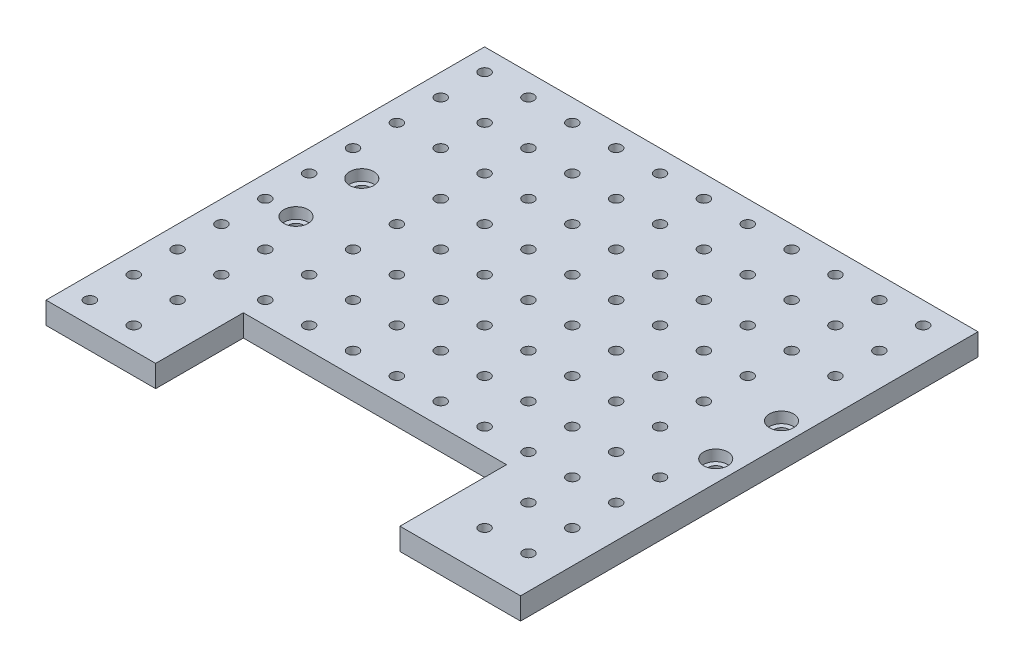
from build123d import *

# Parameters (mm, degrees)
SKETCH1_R           = 3.175
BOSS_EXTRUDE1_DEPTH = 12.7
SKETCH2_R           = 6.985
CUT_EXTRUDE1_DEPTH  = 6.35
SKETCH2_3_R         = 4.191
CUT_EXTRUDE2_DEPTH  = 12.7


with BuildPart() as part:
    # Sketch1 → Boss-Extrude1 (new body)
    with BuildSketch(Plane(origin=(0, 0, 0), x_dir=(1, 0, 0), z_dir=(0, 1, 0))):
        Polygon((63.5, 0), (215.9, 0), (215.9, -61.722), (285.75, -61.722), (285.75, 0), (285.75, 203.2), (0, 203.2), (0, 0), (0, -50.8), (63.5, -50.8), align=None)
        with Locations(Location((12.7, 190.5, 0), (0, 0, 270))):
            Circle(SKETCH1_R, mode=Mode.SUBTRACT)
        with Locations(Location((38.1, 190.5, 0), (0, 0, 270))):
            Circle(SKETCH1_R, mode=Mode.SUBTRACT)
        with Locations(Location((63.5, 190.5, 0), (0, 0, 270))):
            Circle(SKETCH1_R, mode=Mode.SUBTRACT)
        with Locations(Location((88.9, 190.5, 0), (0, 0, 270))):
            Circle(SKETCH1_R, mode=Mode.SUBTRACT)
        with Locations(Location((114.3, 190.5, 0), (0, 0, 270))):
            Circle(SKETCH1_R, mode=Mode.SUBTRACT)
        with Locations(Location((139.7, 190.5, 0), (0, 0, 270))):
            Circle(SKETCH1_R, mode=Mode.SUBTRACT)
        with Locations(Location((165.1, 190.5, 0), (0, 0, 270))):
            Circle(SKETCH1_R, mode=Mode.SUBTRACT)
        with Locations(Location((190.5, 190.5, 0), (0, 0, 270))):
            Circle(SKETCH1_R, mode=Mode.SUBTRACT)
        with Locations(Location((215.9, 190.5, 0), (0, 0, 270))):
            Circle(SKETCH1_R, mode=Mode.SUBTRACT)
        with Locations(Location((241.3, 190.5, 0), (0, 0, 270))):
            Circle(SKETCH1_R, mode=Mode.SUBTRACT)
        with Locations(Location((266.7, 190.5, 0), (0, 0, 270))):
            Circle(SKETCH1_R, mode=Mode.SUBTRACT)
        with Locations(Location((38.1, 165.1, 0), (0, 0, 270))):
            Circle(SKETCH1_R, mode=Mode.SUBTRACT)
        with Locations(Location((63.5, 165.1, 0), (0, 0, 270))):
            Circle(SKETCH1_R, mode=Mode.SUBTRACT)
        with Locations(Location((88.9, 165.1, 0), (0, 0, 270))):
            Circle(SKETCH1_R, mode=Mode.SUBTRACT)
        with Locations(Location((114.3, 165.1, 0), (0, 0, 270))):
            Circle(SKETCH1_R, mode=Mode.SUBTRACT)
        with Locations(Location((139.7, 165.1, 0), (0, 0, 270))):
            Circle(SKETCH1_R, mode=Mode.SUBTRACT)
        with Locations(Location((165.1, 165.1, 0), (0, 0, 270))):
            Circle(SKETCH1_R, mode=Mode.SUBTRACT)
        with Locations(Location((190.5, 165.1, 0), (0, 0, 270))):
            Circle(SKETCH1_R, mode=Mode.SUBTRACT)
        with Locations(Location((215.9, 165.1, 0), (0, 0, 270))):
            Circle(SKETCH1_R, mode=Mode.SUBTRACT)
        with Locations(Location((241.3, 165.1, 0), (0, 0, 270))):
            Circle(SKETCH1_R, mode=Mode.SUBTRACT)
        with Locations(Location((266.7, 165.1, 0), (0, 0, 270))):
            Circle(SKETCH1_R, mode=Mode.SUBTRACT)
        with Locations(Location((38.1, 139.7, 0), (0, 0, 270))):
            Circle(SKETCH1_R, mode=Mode.SUBTRACT)
        with Locations(Location((63.5, 139.7, 0), (0, 0, 270))):
            Circle(SKETCH1_R, mode=Mode.SUBTRACT)
        with Locations(Location((88.9, 139.7, 0), (0, 0, 270))):
            Circle(SKETCH1_R, mode=Mode.SUBTRACT)
        with Locations(Location((114.3, 139.7, 0), (0, 0, 270))):
            Circle(SKETCH1_R, mode=Mode.SUBTRACT)
        with Locations(Location((139.7, 139.7, 0), (0, 0, 270))):
            Circle(SKETCH1_R, mode=Mode.SUBTRACT)
        with Locations(Location((165.1, 139.7, 0), (0, 0, 270))):
            Circle(SKETCH1_R, mode=Mode.SUBTRACT)
        with Locations(Location((190.5, 139.7, 0), (0, 0, 270))):
            Circle(SKETCH1_R, mode=Mode.SUBTRACT)
        with Locations(Location((215.9, 139.7, 0), (0, 0, 270))):
            Circle(SKETCH1_R, mode=Mode.SUBTRACT)
        with Locations(Location((241.3, 139.7, 0), (0, 0, 270))):
            Circle(SKETCH1_R, mode=Mode.SUBTRACT)
        with Locations(Location((266.7, 139.7, 0), (0, 0, 270))):
            Circle(SKETCH1_R, mode=Mode.SUBTRACT)
        with Locations(Location((63.5, 114.3, 0), (0, 0, 270))):
            Circle(SKETCH1_R, mode=Mode.SUBTRACT)
        with Locations(Location((88.9, 114.3, 0), (0, 0, 270))):
            Circle(SKETCH1_R, mode=Mode.SUBTRACT)
        with Locations(Location((114.3, 114.3, 0), (0, 0, 270))):
            Circle(SKETCH1_R, mode=Mode.SUBTRACT)
        with Locations(Location((139.7, 114.3, 0), (0, 0, 270))):
            Circle(SKETCH1_R, mode=Mode.SUBTRACT)
        with Locations(Location((165.1, 114.3, 0), (0, 0, 270))):
            Circle(SKETCH1_R, mode=Mode.SUBTRACT)
        with Locations(Location((190.5, 114.3, 0), (0, 0, 270))):
            Circle(SKETCH1_R, mode=Mode.SUBTRACT)
        with Locations(Location((215.9, 114.3, 0), (0, 0, 270))):
            Circle(SKETCH1_R, mode=Mode.SUBTRACT)
        with Locations(Location((241.3, 114.3, 0), (0, 0, 270))):
            Circle(SKETCH1_R, mode=Mode.SUBTRACT)
        with Locations(Location((63.5, 88.9, 0), (0, 0, 270))):
            Circle(SKETCH1_R, mode=Mode.SUBTRACT)
        with Locations(Location((88.9, 88.9, 0), (0, 0, 270))):
            Circle(SKETCH1_R, mode=Mode.SUBTRACT)
        with Locations(Location((114.3, 88.9, 0), (0, 0, 270))):
            Circle(SKETCH1_R, mode=Mode.SUBTRACT)
        with Locations(Location((139.7, 88.9, 0), (0, 0, 270))):
            Circle(SKETCH1_R, mode=Mode.SUBTRACT)
        with Locations(Location((165.1, 88.9, 0), (0, 0, 270))):
            Circle(SKETCH1_R, mode=Mode.SUBTRACT)
        with Locations(Location((190.5, 88.9, 0), (0, 0, 270))):
            Circle(SKETCH1_R, mode=Mode.SUBTRACT)
        with Locations(Location((215.9, 88.9, 0), (0, 0, 270))):
            Circle(SKETCH1_R, mode=Mode.SUBTRACT)
        with Locations(Location((241.3, 88.9, 0), (0, 0, 270))):
            Circle(SKETCH1_R, mode=Mode.SUBTRACT)
        with Locations(Location((63.5, 63.5, 0), (0, 0, 270))):
            Circle(SKETCH1_R, mode=Mode.SUBTRACT)
        with Locations(Location((88.9, 63.5, 0), (0, 0, 270))):
            Circle(SKETCH1_R, mode=Mode.SUBTRACT)
        with Locations(Location((114.3, 63.5, 0), (0, 0, 270))):
            Circle(SKETCH1_R, mode=Mode.SUBTRACT)
        with Locations(Location((139.7, 63.5, 0), (0, 0, 270))):
            Circle(SKETCH1_R, mode=Mode.SUBTRACT)
        with Locations(Location((165.1, 63.5, 0), (0, 0, 270))):
            Circle(SKETCH1_R, mode=Mode.SUBTRACT)
        with Locations(Location((190.5, 63.5, 0), (0, 0, 270))):
            Circle(SKETCH1_R, mode=Mode.SUBTRACT)
        with Locations(Location((215.9, 63.5, 0), (0, 0, 270))):
            Circle(SKETCH1_R, mode=Mode.SUBTRACT)
        with Locations(Location((241.3, 63.5, 0), (0, 0, 270))):
            Circle(SKETCH1_R, mode=Mode.SUBTRACT)
        with Locations(Location((38.1, 38.1, 0), (0, 0, 270))):
            Circle(SKETCH1_R, mode=Mode.SUBTRACT)
        with Locations(Location((63.5, 38.1, 0), (0, 0, 270))):
            Circle(SKETCH1_R, mode=Mode.SUBTRACT)
        with Locations(Location((88.9, 38.1, 0), (0, 0, 270))):
            Circle(SKETCH1_R, mode=Mode.SUBTRACT)
        with Locations(Location((114.3, 38.1, 0), (0, 0, 270))):
            Circle(SKETCH1_R, mode=Mode.SUBTRACT)
        with Locations(Location((139.7, 38.1, 0), (0, 0, 270))):
            Circle(SKETCH1_R, mode=Mode.SUBTRACT)
        with Locations(Location((165.1, 38.1, 0), (0, 0, 270))):
            Circle(SKETCH1_R, mode=Mode.SUBTRACT)
        with Locations(Location((190.5, 38.1, 0), (0, 0, 270))):
            Circle(SKETCH1_R, mode=Mode.SUBTRACT)
        with Locations(Location((215.9, 38.1, 0), (0, 0, 270))):
            Circle(SKETCH1_R, mode=Mode.SUBTRACT)
        with Locations(Location((241.3, 38.1, 0), (0, 0, 270))):
            Circle(SKETCH1_R, mode=Mode.SUBTRACT)
        with Locations(Location((266.7, 38.1, 0), (0, 0, 270))):
            Circle(SKETCH1_R, mode=Mode.SUBTRACT)
        with Locations(Location((38.1, 12.7, 0), (0, 0, 270))):
            Circle(SKETCH1_R, mode=Mode.SUBTRACT)
        with Locations(Location((63.5, 12.7, 0), (0, 0, 270))):
            Circle(SKETCH1_R, mode=Mode.SUBTRACT)
        with Locations(Location((88.9, 12.7, 0), (0, 0, 270))):
            Circle(SKETCH1_R, mode=Mode.SUBTRACT)
        with Locations(Location((114.3, 12.7, 0), (0, 0, 270))):
            Circle(SKETCH1_R, mode=Mode.SUBTRACT)
        with Locations(Location((139.7, 12.7, 0), (0, 0, 270))):
            Circle(SKETCH1_R, mode=Mode.SUBTRACT)
        with Locations(Location((165.1, 12.7, 0), (0, 0, 270))):
            Circle(SKETCH1_R, mode=Mode.SUBTRACT)
        with Locations(Location((190.5, 12.7, 0), (0, 0, 270))):
            Circle(SKETCH1_R, mode=Mode.SUBTRACT)
        with Locations(Location((215.9, 12.7, 0), (0, 0, 270))):
            Circle(SKETCH1_R, mode=Mode.SUBTRACT)
        with Locations(Location((241.3, 12.7, 0), (0, 0, 270))):
            Circle(SKETCH1_R, mode=Mode.SUBTRACT)
        with Locations(Location((266.7, 12.7, 0), (0, 0, 270))):
            Circle(SKETCH1_R, mode=Mode.SUBTRACT)
        with Locations(Location((38.1, -12.7, 0), (0, 0, 270))):
            Circle(SKETCH1_R, mode=Mode.SUBTRACT)
        with Locations(Location((241.3, -12.7, 0), (0, 0, 270))):
            Circle(SKETCH1_R, mode=Mode.SUBTRACT)
        with Locations(Location((266.7, -12.7, 0), (0, 0, 270))):
            Circle(SKETCH1_R, mode=Mode.SUBTRACT)
        with Locations(Location((38.1, -38.1, 0), (0, 0, 270))):
            Circle(SKETCH1_R, mode=Mode.SUBTRACT)
        with Locations(Location((241.3, -38.1, 0), (0, 0, 270))):
            Circle(SKETCH1_R, mode=Mode.SUBTRACT)
        with Locations(Location((266.7, -38.1, 0), (0, 0, 270))):
            Circle(SKETCH1_R, mode=Mode.SUBTRACT)
        with Locations(Location((12.7, 165.1, 0), (0, 0, 270))):
            Circle(SKETCH1_R, mode=Mode.SUBTRACT)
        with Locations(Location((12.7, 139.7, 0), (0, 0, 270))):
            Circle(SKETCH1_R, mode=Mode.SUBTRACT)
        with Locations(Location((12.7, 114.3, 0), (0, 0, 270))):
            Circle(SKETCH1_R, mode=Mode.SUBTRACT)
        with Locations(Location((12.7, 88.9, 0), (0, 0, 270))):
            Circle(SKETCH1_R, mode=Mode.SUBTRACT)
        with Locations(Location((12.7, 63.5, 0), (0, 0, 270))):
            Circle(SKETCH1_R, mode=Mode.SUBTRACT)
        with Locations(Location((12.7, 38.1, 0), (0, 0, 270))):
            Circle(SKETCH1_R, mode=Mode.SUBTRACT)
        with Locations(Location((12.7, 12.7, 0), (0, 0, 270))):
            Circle(SKETCH1_R, mode=Mode.SUBTRACT)
        with Locations(Location((12.7, -12.7, 0), (0, 0, 270))):
            Circle(SKETCH1_R, mode=Mode.SUBTRACT)
        with Locations(Location((12.7, -38.1, 0), (0, 0, 270))):
            Circle(SKETCH1_R, mode=Mode.SUBTRACT)
    extrude(amount=BOSS_EXTRUDE1_DEPTH)

    # Sketch2 → Cut-Extrude1 (cut)
    with BuildSketch(Plane(origin=(0, 12.7, 0), x_dir=(1, 0, 0), z_dir=(0, 1, 0))):
        with Locations(Location((30.48, 101.6, 0), (0, 0, 270))):
            Circle(SKETCH2_R)
        with Locations(Location((30.48, 63.5, 0), (0, 0, 270))):
            Circle(SKETCH2_R)
        with Locations(Location((273.558, 101.6, 0), (0, 0, 270))):
            Circle(SKETCH2_R)
        with Locations(Location((273.558, 63.5, 0), (0, 0, 270))):
            Circle(SKETCH2_R)
    extrude(amount=-CUT_EXTRUDE1_DEPTH, mode=Mode.SUBTRACT)

    # Sketch2<3> → Cut-Extrude2 (cut)
    with BuildSketch(Plane(origin=(0, 12.7, 0), x_dir=(1, 0, 0), z_dir=(0, 1, 0))):
        with Locations(Location((273.558, 101.6, 0), (0, 0, 270))):
            Circle(SKETCH2_3_R)
        with Locations(Location((30.48, 63.5, 0), (0, 0, 270))):
            Circle(SKETCH2_3_R)
        with Locations(Location((30.48, 101.6, 0), (0, 0, 270))):
            Circle(SKETCH2_3_R)
        with Locations(Location((273.558, 63.5, 0), (0, 0, 270))):
            Circle(SKETCH2_3_R)
    extrude(amount=-CUT_EXTRUDE2_DEPTH, mode=Mode.SUBTRACT)


solid = part.part
